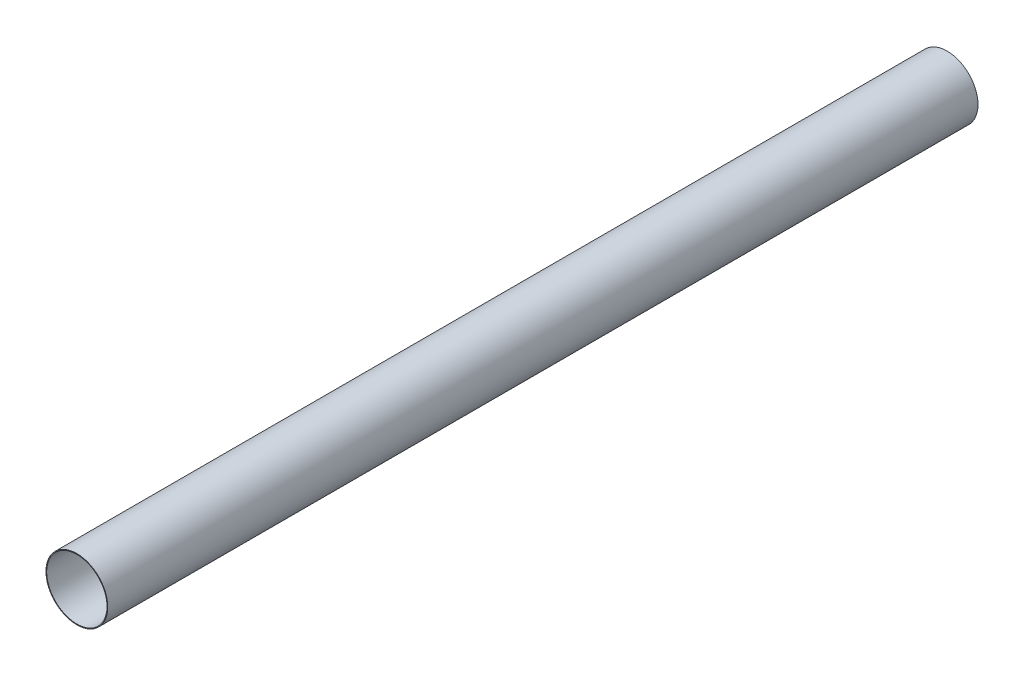
from build123d import *

# Parameters (mm, degrees)
SKETCH1_R           = 21.3
SKETCH1_R_2         = 20.8
BOSS_EXTRUDE1_DEPTH = 300


with BuildPart() as part:
    # Sketch1 → Boss-Extrude1 (new, symmetric)
    with BuildSketch(Plane.XY):
        Circle(SKETCH1_R)
        Circle(SKETCH1_R_2, mode=Mode.SUBTRACT)
    extrude(amount=BOSS_EXTRUDE1_DEPTH, both=True)


solid = part.part
